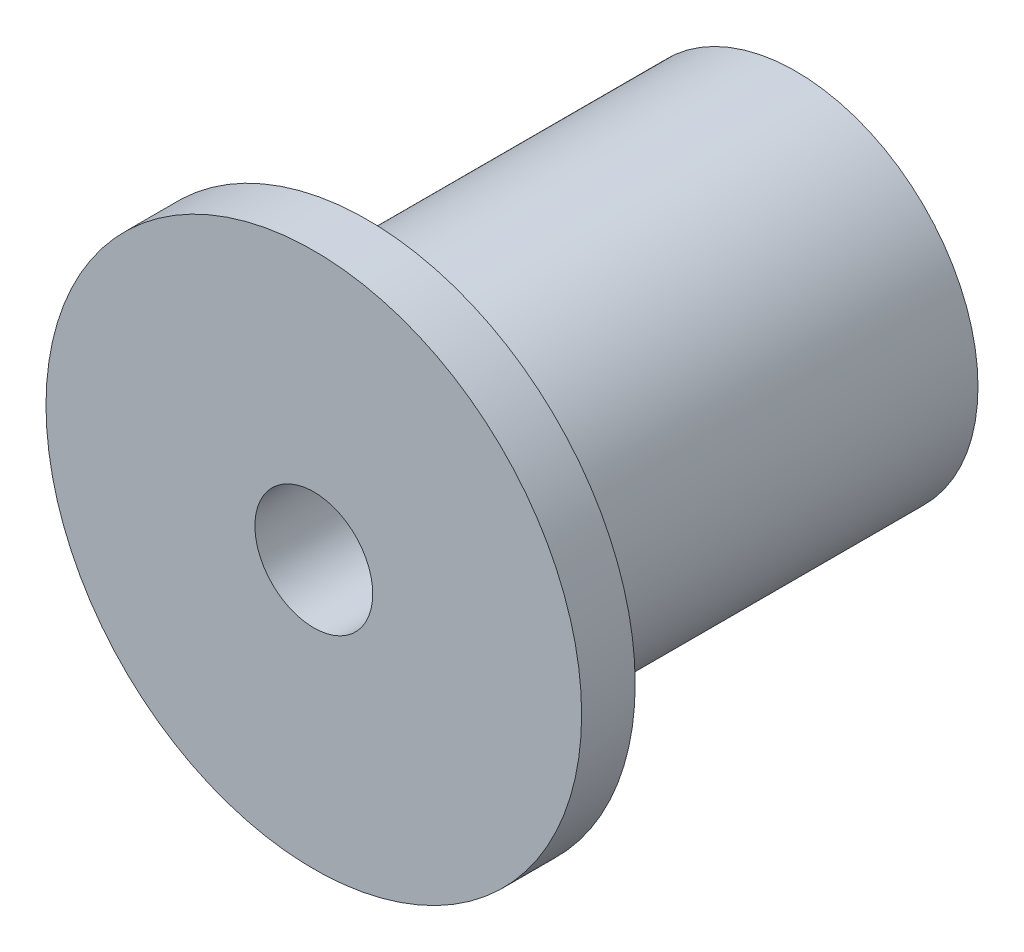
from build123d import *

# Parameters (mm, degrees)
SKETCH1_R           = 8.636
SKETCH1_R_2         = 2.794
BOSS_EXTRUDE1_DEPTH = 20.32
SKETCH2_R           = 12.7
SKETCH2_R_2         = 2.794
BOSS_EXTRUDE2_DEPTH = 2.54


with BuildPart() as part:
    # Sketch1 → Boss-Extrude1 (new body)
    with BuildSketch(Plane.XY):
        Circle(SKETCH1_R)
        Circle(SKETCH1_R_2, mode=Mode.SUBTRACT)
    extrude(amount=BOSS_EXTRUDE1_DEPTH)

    # Sketch2 → Boss-Extrude2 (add)
    with BuildSketch(Plane.XY.offset(20.32)):
        Circle(SKETCH2_R)
        Circle(SKETCH2_R_2, mode=Mode.SUBTRACT)
    extrude(amount=BOSS_EXTRUDE2_DEPTH)


solid = part.part
